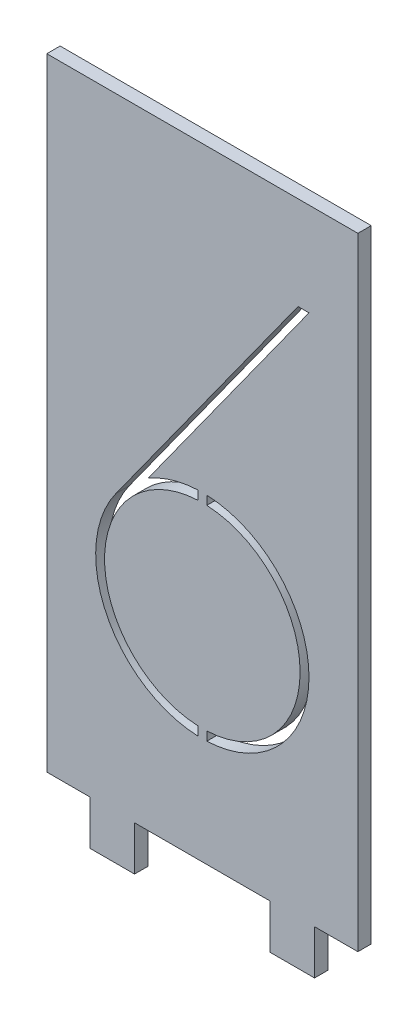
from build123d import *

# Parameters (mm, degrees)
SKIZZE1_W                        = 35
SKIZZE1_H                        = 75
AUFSATZ_LINEAR_AUSTRAGEN1_DEPTH  = 1.5
SKIZZE3_W                        = 15.25
SKIZZE3_H                        = 5
SKIZZE3_W_2                      = 4.875
SCHNITT_LINEAR_AUSTRAGEN12_DEPTH = 20
SKIZZE10_R                       = 12
SKIZZE10_R_2                     = 11
SCHNITT_LINEAR_AUSTRAGEN16_DEPTH = 1.5
SCHNITT_LINEAR_AUSTRAGEN17_DEPTH = 1.5
SKIZZE12_W                       = 1
SKIZZE12_H                       = 28.144103088
AUFSATZ_LINEAR_AUSTRAGEN7_DEPTH  = 1.5


with BuildPart() as part:
    # Skizze1 → Aufsatz-Linear austragen1 (new body)
    with BuildSketch(Plane.XY):
        with Locations((17.5, 37.5)):
            Rectangle(SKIZZE1_W, SKIZZE1_H)
    extrude(amount=AUFSATZ_LINEAR_AUSTRAGEN1_DEPTH)

    # Skizze3 → Schnitt-Linear austragen12 (cut)
    with BuildSketch(Plane.XY.offset(1.5)):
        with Locations((17.5, 2.5)):
            Rectangle(SKIZZE3_W, SKIZZE3_H)
        with Locations((32.5625, 2.5)):
            Rectangle(SKIZZE3_W_2, SKIZZE3_H)
        with Locations((2.4375, 2.5)):
            Rectangle(SKIZZE3_W_2, SKIZZE3_H)
    extrude(amount=-SCHNITT_LINEAR_AUSTRAGEN12_DEPTH, mode=Mode.SUBTRACT)

    # Skizze10 → Schnitt-Linear austragen16 (cut)
    with BuildSketch(Plane.XY.offset(1.5)):
        with Locations((17.5, 29)):
            Circle(SKIZZE10_R)
        with Locations((17.5, 29)):
            Circle(SKIZZE10_R_2, mode=Mode.SUBTRACT)
    extrude(amount=-SCHNITT_LINEAR_AUSTRAGEN16_DEPTH, mode=Mode.SUBTRACT)


with BuildPart() as schnitt_linear_austragen16_piece_1:
    # of the separate pieces the step leaves, piece 1, a body of its own (schnitt_linear_austragen16_pieces)
    add(part.part.solids().sort_by_distance((4.875, 0, 0))[0])


with BuildPart() as schnitt_linear_austragen16_piece_2:
    # of the separate pieces the step leaves, piece 2, a body of its own (schnitt_linear_austragen16_pieces)
    add(part.part.solids().sort_by_distance((28.5, 29, 0))[0])


with BuildPart() as schnitt_linear_austragen17_tool:
    # Skizze11 → Schnitt-Linear austragen17 (new body)
    with BuildSketch(Plane.XY.offset(1.5)):
        Polygon((28.268155747, 64.5), (29.5, 64.5), (8.288020016, 35.011607504), (7.787416934, 36.04739173), align=None)
    extrude(amount=-SCHNITT_LINEAR_AUSTRAGEN17_DEPTH)


with BuildPart() as schnitt_linear_austragen16_piece_1_1:
    add(schnitt_linear_austragen16_piece_1.part)

    # Schnitt-Linear austragen17: cut by schnitt_linear_austragen17_tool
    add(schnitt_linear_austragen17_tool.part, mode=Mode.SUBTRACT)



with BuildPart() as schnitt_linear_austragen16_piece_2_1:
    add(schnitt_linear_austragen16_piece_2.part)

    # Schnitt-Linear austragen17: cut by schnitt_linear_austragen17_tool
    add(schnitt_linear_austragen17_tool.part, mode=Mode.SUBTRACT)


with BuildPart() as schnitt_linear_austragen16_piece_1_2:
    add(schnitt_linear_austragen16_piece_1_1.part)

    add(schnitt_linear_austragen16_piece_2_1.part)  # Aufsatz-Linear austragen7 merges Schnitt-Linear austragen16 piece 2
    # Skizze12 → Aufsatz-Linear austragen7 (add)
    with BuildSketch(Plane.XY.offset(1.5)):
        with Locations((17.5, 28.571124528)):
            Rectangle(SKIZZE12_W, SKIZZE12_H)
    extrude(amount=-AUFSATZ_LINEAR_AUSTRAGEN7_DEPTH)


solid = schnitt_linear_austragen16_piece_1_2.part
